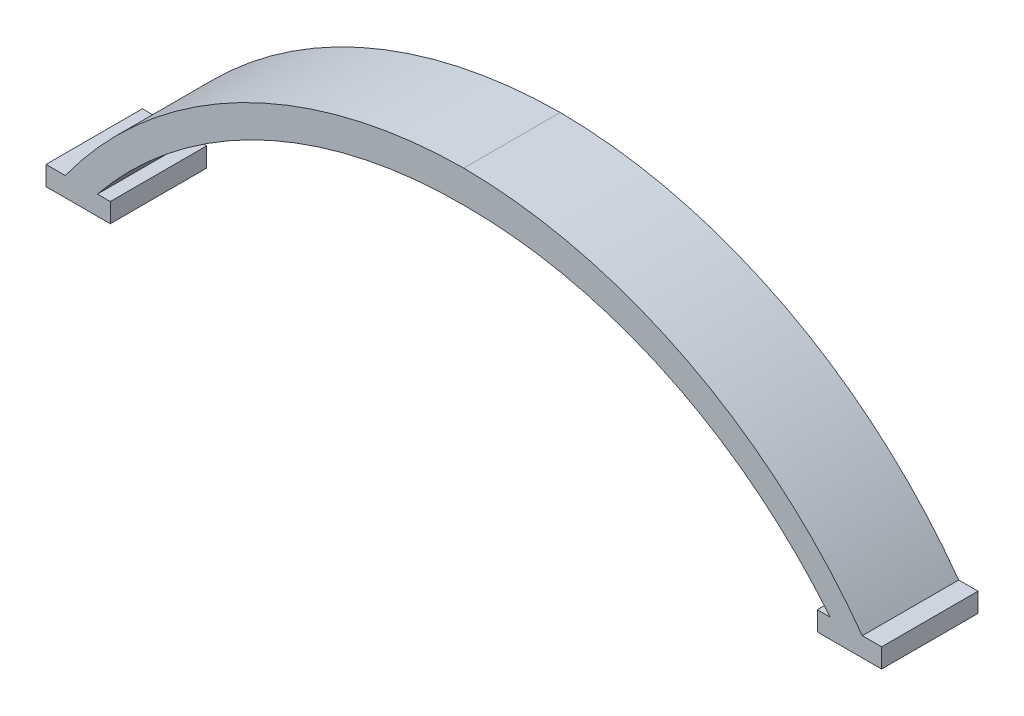
from build123d import *

# Parameters (mm, degrees)
BOSS_EXTRUDE1_DEPTH = 19.05


with BuildPart() as part:
    # Sketch1 → Boss-Extrude1 (new body)
    with BuildSketch(Plane.XY):
        with BuildLine():
            Line((0, 0), (12.7, 0))
            Line((12.7, 0), (12.7, 3.81))
            Line((12.7, 3.81), (10.16, 3.81))
            ThreePointArc((10.16, 3.81), (42.442039197, 29.215695028), (82.55, 38.1))
            ThreePointArc((82.55, 38.1), (122.657960803, 29.215695028), (154.94, 3.81))
            Line((154.94, 3.81), (152.4, 3.81))
            Line((152.4, 3.81), (152.4, 0))
            Line((152.4, 0), (165.1, 0))
            Line((165.1, 0), (165.1, 3.81))
            Line((165.1, 3.81), (161.29, 3.81))
            ThreePointArc((161.29, 3.81), (126.781281636, 33.54873317), (82.55, 44.45))
            ThreePointArc((82.55, 44.45), (38.318718364, 33.54873317), (3.81, 3.81))
            Line((3.81, 3.81), (0, 3.81))
            Line((0, 3.81), (0, 0))
        make_face()
    extrude(amount=BOSS_EXTRUDE1_DEPTH)


solid = part.part
